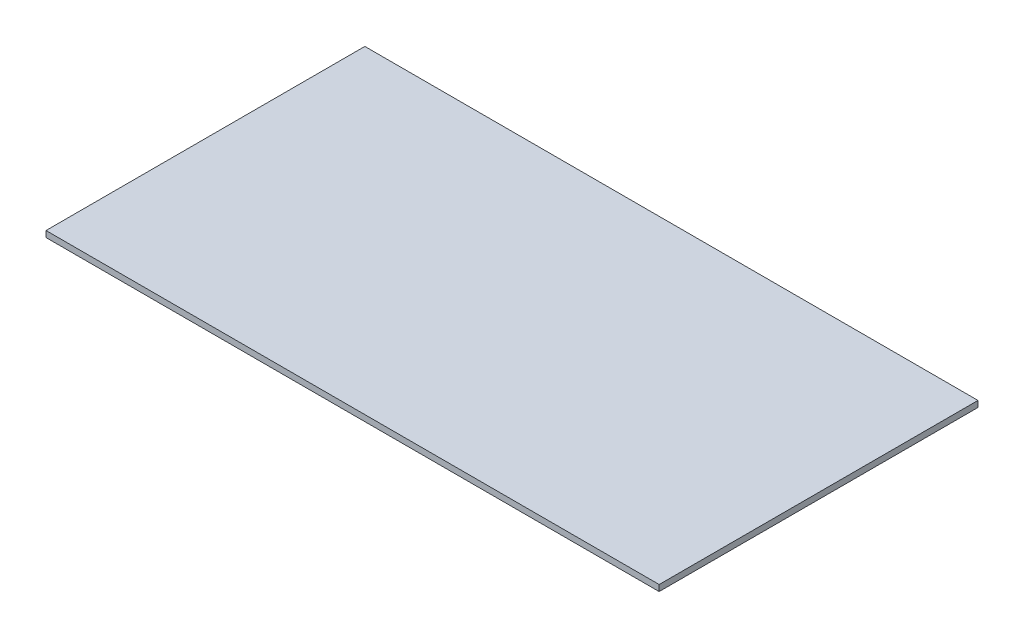
from build123d import *

# Parameters (mm, degrees)
SKETCH1_W           = 500
SKETCH1_H           = 260
BOSS_EXTRUDE1_DEPTH = 5


with BuildPart() as part:
    # Sketch1 → Boss-Extrude1 (new body)
    with BuildSketch(Plane(origin=(0, 0, 0), x_dir=(1, 0, 0), z_dir=(0, 1, 0))):
        Rectangle(SKETCH1_W, SKETCH1_H)
    extrude(amount=BOSS_EXTRUDE1_DEPTH)


solid = part.part
